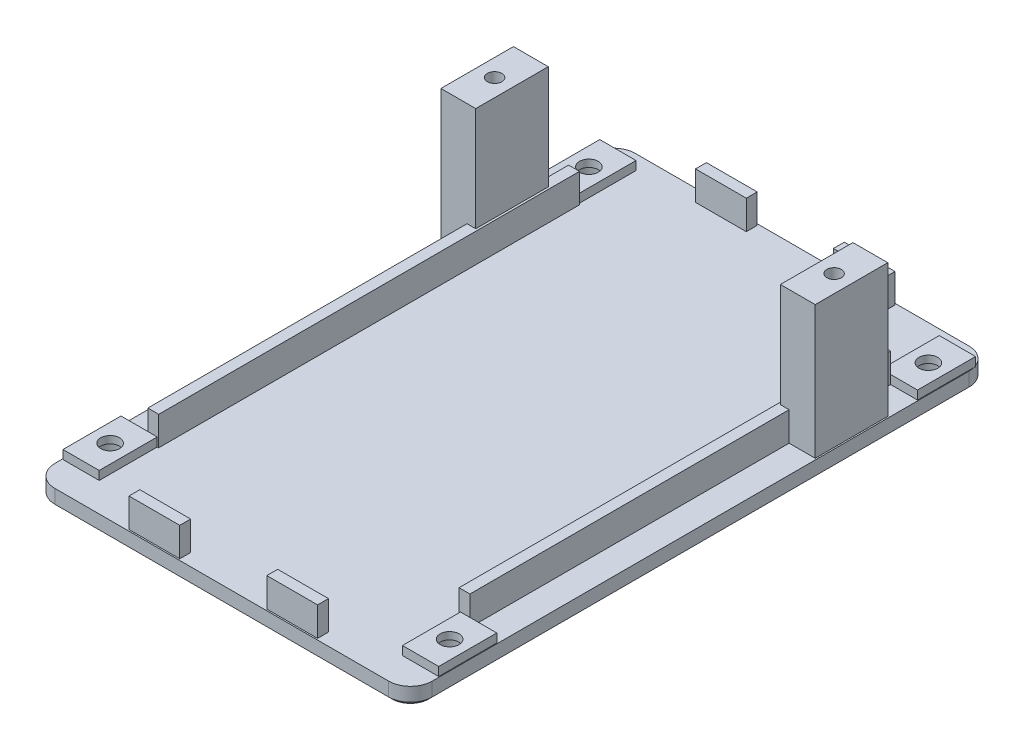
from build123d import *

# Parameters (mm, degrees)
BOSS_EXTRUDE1_DEPTH  = 2.4
CHAMFER1_SIZE        = 0.5
BOSS_EXTRUDE2_START  = -52
SKETCH2_W            = 5
SKETCH2_H            = 1.21
BOSS_EXTRUDE2_DEPTH  = 8
BOSS_EXTRUDE3_START  = 14
SKETCH3_W            = 5
SKETCH3_H            = 1.21
BOSS_EXTRUDE3_DEPTH  = 8
BOSS_EXTRUDE4_START  = -52
SKETCH4_W            = 5
SKETCH4_H            = 1.21
BOSS_EXTRUDE4_DEPTH  = 8
BOSS_EXTRUDE5_START  = 14
SKETCH5_W            = 5
SKETCH5_H            = 1.21
BOSS_EXTRUDE5_DEPTH  = 8
BOSS_EXTRUDE6_START  = -44
SKETCH6_W            = 1.5
SKETCH6_H            = 4.01
BOSS_EXTRUDE6_DEPTH  = 58
BOSS_EXTRUDE7_START  = -40
SKETCH7_W            = 4.8
SKETCH7_H            = 18.36
BOSS_EXTRUDE7_DEPTH  = 10
BOSS_EXTRUDE8_START  = 8
SKETCH8_R            = 1
BOSS_EXTRUDE8_DEPTH  = 13.75
BOSS_EXTRUDE9_START  = -53.8
SKETCH9_W            = 7
SKETCH9_H            = 4.01
BOSS_EXTRUDE9_DEPTH  = 1.5
BOSS_EXTRUDE10_START = 24.3
SKETCH10_W           = 7
SKETCH10_H           = 4.01
BOSS_EXTRUDE10_DEPTH = 1.5
BOSS_EXTRUDE11_START = -44
SKETCH11_W           = 1.5
SKETCH11_H           = 4.01
BOSS_EXTRUDE11_DEPTH = 58
BOSS_EXTRUDE12_START = -40
SKETCH12_W           = 4.8
SKETCH12_H           = 18.36
BOSS_EXTRUDE12_DEPTH = 10
BOSS_EXTRUDE13_START = 8
SKETCH13_R           = 1
BOSS_EXTRUDE13_DEPTH = 13.75
BOSS_EXTRUDE14_START = -53.8
SKETCH14_W           = 7
SKETCH14_H           = 4.01
BOSS_EXTRUDE14_DEPTH = 1.5
BOSS_EXTRUDE15_START = 24.3
SKETCH15_W           = 7
SKETCH15_H           = 4.01
BOSS_EXTRUDE15_DEPTH = 1.5
BOSS_EXTRUDE16_START = -1
SKETCH16_R           = 2.1
BOSS_EXTRUDE16_DEPTH = 3.6
BOSS_EXTRUDE17_START = 2.5
SKETCH17_R           = 1.3
BOSS_EXTRUDE17_DEPTH = 1.2
BOSS_EXTRUDE18_START = -1
SKETCH18_R           = 2.1
BOSS_EXTRUDE18_DEPTH = 3.6
BOSS_EXTRUDE19_START = 2.5
SKETCH19_R           = 1.3
BOSS_EXTRUDE19_DEPTH = 1.2
BOSS_EXTRUDE20_START = -1
SKETCH20_R           = 2.1
BOSS_EXTRUDE20_DEPTH = 3.6
BOSS_EXTRUDE21_START = 2.5
SKETCH21_R           = 1.3
BOSS_EXTRUDE21_DEPTH = 1.2
BOSS_EXTRUDE22_START = -1
SKETCH22_R           = 2.1
BOSS_EXTRUDE22_DEPTH = 3.6
BOSS_EXTRUDE23_START = 2.5
SKETCH23_R           = 1.3
BOSS_EXTRUDE23_DEPTH = 1.2
BOSS_EXTRUDE24_START = -54.1
SKETCH24_W           = 4
SKETCH24_H           = 0.9
BOSS_EXTRUDE24_DEPTH = 1


with BuildPart() as part:
    # Sketch1 → Boss-Extrude1 (new body)
    with BuildSketch(Plane(origin=(0, 0, 0), x_dir=(1, 0, 0), z_dir=(0, 1, 0))):
        with BuildLine():
            Line((-23, 54), (23, 54))
            ThreePointArc((23, 54), (25.121320344, 53.121320344), (26, 51))
            Line((26, 51), (26, -23))
            ThreePointArc((26, -23), (25.121320344, -25.121320344), (23, -26))
            Line((23, -26), (-23, -26))
            ThreePointArc((-23, -26), (-25.121320344, -25.121320344), (-26, -23))
            Line((-26, -23), (-26, 51))
            ThreePointArc((-26, 51), (-25.121320344, 53.121320344), (-23, 54))
        make_face()
    extrude(amount=BOSS_EXTRUDE1_DEPTH)

    # Chamfer1
    chamfer1_edges = [part.edges().sort_by_distance(p)[0] for p in [
        (0, 0, 26),
        (-25.121320344, 0, 25.121320344),
        (-26, 0, -14),
        (-25.121320344, 0, -53.121320344),
        (0, 0, -54),
        (25.121320344, 0, -53.121320344),
        (26, 0, -14),
        (25.121320344, 0, 25.121320344),
    ]]
    chamfer(chamfer1_edges, length=CHAMFER1_SIZE)

    # Sketch2 → Boss-Extrude2 (add)
    with BuildSketch(Plane.XY.offset(BOSS_EXTRUDE2_START)):
        with Locations((-23.4, 2.995)):
            Rectangle(SKETCH2_W, SKETCH2_H)
    extrude(amount=BOSS_EXTRUDE2_DEPTH)

    # Sketch3 → Boss-Extrude3 (add)
    with BuildSketch(Plane.XY.offset(BOSS_EXTRUDE3_START)):
        with Locations((-23.4, 2.995)):
            Rectangle(SKETCH3_W, SKETCH3_H)
    extrude(amount=BOSS_EXTRUDE3_DEPTH)

    # Sketch4 → Boss-Extrude4 (add)
    with BuildSketch(Plane.XY.offset(BOSS_EXTRUDE4_START)):
        with Locations((23.4, 2.995)):
            Rectangle(SKETCH4_W, SKETCH4_H)
    extrude(amount=BOSS_EXTRUDE4_DEPTH)

    # Sketch5 → Boss-Extrude5 (add)
    with BuildSketch(Plane.XY.offset(BOSS_EXTRUDE5_START)):
        with Locations((23.4, 2.995)):
            Rectangle(SKETCH5_W, SKETCH5_H)
    extrude(amount=BOSS_EXTRUDE5_DEPTH)

    # Sketch6 → Boss-Extrude6 (add)
    with BuildSketch(Plane.XY.offset(BOSS_EXTRUDE6_START)):
        with Locations((-21.45, 4.395)):
            Rectangle(SKETCH6_W, SKETCH6_H)
    extrude(amount=BOSS_EXTRUDE6_DEPTH)

    # Sketch7 → Boss-Extrude7 (add)
    with BuildSketch(Plane.XY.offset(BOSS_EXTRUDE7_START)):
        with Locations((-23.4, 11.57)):
            Rectangle(SKETCH7_W, SKETCH7_H)
    extrude(amount=BOSS_EXTRUDE7_DEPTH)


with BuildPart() as body_2:
    # Sketch8 → Boss-Extrude8 (new body)
    with BuildSketch(Plane(origin=(0, 0, 0), x_dir=(1, 0, 0), z_dir=(0, 1, 0)).offset(BOSS_EXTRUDE8_START)):
        with Locations(Location((-23.4, 35, 0), (0, 0, 270))):
            Circle(SKETCH8_R)
    extrude(amount=BOSS_EXTRUDE8_DEPTH)


with BuildPart() as part_1:
    add(part.part)

    # Combine1: cut body 2
    add(body_2.part, mode=Mode.SUBTRACT)

    # Sketch9 → Boss-Extrude9 (add)
    with BuildSketch(Plane.XY.offset(BOSS_EXTRUDE9_START)):
        with Locations((-9.5, 4.395)):
            Rectangle(SKETCH9_W, SKETCH9_H)
    extrude(amount=BOSS_EXTRUDE9_DEPTH)

    # Sketch10 → Boss-Extrude10 (add)
    with BuildSketch(Plane.XY.offset(BOSS_EXTRUDE10_START)):
        with Locations((-9.5, 4.395)):
            Rectangle(SKETCH10_W, SKETCH10_H)
    extrude(amount=BOSS_EXTRUDE10_DEPTH)

    # Sketch11 → Boss-Extrude11 (add)
    with BuildSketch(Plane.XY.offset(BOSS_EXTRUDE11_START)):
        with Locations((21.45, 4.395)):
            Rectangle(SKETCH11_W, SKETCH11_H)
    extrude(amount=BOSS_EXTRUDE11_DEPTH)

    # Sketch12 → Boss-Extrude12 (add)
    with BuildSketch(Plane.XY.offset(BOSS_EXTRUDE12_START)):
        with Locations((23.4, 11.57)):
            Rectangle(SKETCH12_W, SKETCH12_H)
    extrude(amount=BOSS_EXTRUDE12_DEPTH)


with BuildPart() as body_2_2:
    # Sketch13 → Boss-Extrude13 (new body)
    with BuildSketch(Plane(origin=(0, 0, 0), x_dir=(1, 0, 0), z_dir=(0, 1, 0)).offset(BOSS_EXTRUDE13_START)):
        with Locations(Location((23.4, 35, 0), (0, 0, 270))):
            Circle(SKETCH13_R)
    extrude(amount=BOSS_EXTRUDE13_DEPTH)


with BuildPart() as part_2:
    add(part_1.part)

    # Combine2: cut body 2 2
    add(body_2_2.part, mode=Mode.SUBTRACT)

    # Sketch14 → Boss-Extrude14 (add)
    with BuildSketch(Plane.XY.offset(BOSS_EXTRUDE14_START)):
        with Locations((9.5, 4.395)):
            Rectangle(SKETCH14_W, SKETCH14_H)
    extrude(amount=BOSS_EXTRUDE14_DEPTH)

    # Sketch15 → Boss-Extrude15 (add)
    with BuildSketch(Plane.XY.offset(BOSS_EXTRUDE15_START)):
        with Locations((9.5, 4.395)):
            Rectangle(SKETCH15_W, SKETCH15_H)
    extrude(amount=BOSS_EXTRUDE15_DEPTH)


with BuildPart() as body_2_3:
    # Sketch16 → Boss-Extrude16 (new body)
    with BuildSketch(Plane(origin=(0, 0, 0), x_dir=(1, 0, 0), z_dir=(0, 1, 0)).offset(BOSS_EXTRUDE16_START)):
        with Locations(Location((-23.4, 48, 0), (0, 0, 270))):
            Circle(SKETCH16_R)
    extrude(amount=BOSS_EXTRUDE16_DEPTH)


with BuildPart() as part_3:
    add(part_2.part)

    # Combine3: cut body 2 3
    add(body_2_3.part, mode=Mode.SUBTRACT)


with BuildPart() as body_2_4:
    # Sketch17 → Boss-Extrude17 (new body)
    with BuildSketch(Plane(origin=(0, 0, 0), x_dir=(1, 0, 0), z_dir=(0, 1, 0)).offset(BOSS_EXTRUDE17_START)):
        with Locations(Location((-23.4, 48, 0), (0, 0, 270))):
            Circle(SKETCH17_R)
    extrude(amount=BOSS_EXTRUDE17_DEPTH)


with BuildPart() as part_4:
    add(part_3.part)

    # Combine4: cut body 2 4
    add(body_2_4.part, mode=Mode.SUBTRACT)


with BuildPart() as body_2_5:
    # Sketch18 → Boss-Extrude18 (new body)
    with BuildSketch(Plane(origin=(0, 0, 0), x_dir=(1, 0, 0), z_dir=(0, 1, 0)).offset(BOSS_EXTRUDE18_START)):
        with Locations(Location((-23.4, -18, 0), (0, 0, 270))):
            Circle(SKETCH18_R)
    extrude(amount=BOSS_EXTRUDE18_DEPTH)


with BuildPart() as part_5:
    add(part_4.part)

    # Combine5: cut body 2 5
    add(body_2_5.part, mode=Mode.SUBTRACT)


with BuildPart() as body_2_6:
    # Sketch19 → Boss-Extrude19 (new body)
    with BuildSketch(Plane(origin=(0, 0, 0), x_dir=(1, 0, 0), z_dir=(0, 1, 0)).offset(BOSS_EXTRUDE19_START)):
        with Locations(Location((-23.4, -18, 0), (0, 0, 270))):
            Circle(SKETCH19_R)
    extrude(amount=BOSS_EXTRUDE19_DEPTH)


with BuildPart() as part_6:
    add(part_5.part)

    # Combine6: cut body 2 6
    add(body_2_6.part, mode=Mode.SUBTRACT)


with BuildPart() as body_2_7:
    # Sketch20 → Boss-Extrude20 (new body)
    with BuildSketch(Plane(origin=(0, 0, 0), x_dir=(1, 0, 0), z_dir=(0, 1, 0)).offset(BOSS_EXTRUDE20_START)):
        with Locations(Location((23.4, 48, 0), (0, 0, 270))):
            Circle(SKETCH20_R)
    extrude(amount=BOSS_EXTRUDE20_DEPTH)


with BuildPart() as part_7:
    add(part_6.part)

    # Combine7: cut body 2 7
    add(body_2_7.part, mode=Mode.SUBTRACT)


with BuildPart() as body_2_8:
    # Sketch21 → Boss-Extrude21 (new body)
    with BuildSketch(Plane(origin=(0, 0, 0), x_dir=(1, 0, 0), z_dir=(0, 1, 0)).offset(BOSS_EXTRUDE21_START)):
        with Locations(Location((23.4, 48, 0), (0, 0, 270))):
            Circle(SKETCH21_R)
    extrude(amount=BOSS_EXTRUDE21_DEPTH)


with BuildPart() as part_8:
    add(part_7.part)

    # Combine8: cut body 2 8
    add(body_2_8.part, mode=Mode.SUBTRACT)


with BuildPart() as body_2_9:
    # Sketch22 → Boss-Extrude22 (new body)
    with BuildSketch(Plane(origin=(0, 0, 0), x_dir=(1, 0, 0), z_dir=(0, 1, 0)).offset(BOSS_EXTRUDE22_START)):
        with Locations(Location((23.4, -18, 0), (0, 0, 270))):
            Circle(SKETCH22_R)
    extrude(amount=BOSS_EXTRUDE22_DEPTH)


with BuildPart() as part_9:
    add(part_8.part)

    # Combine9: cut body 2 9
    add(body_2_9.part, mode=Mode.SUBTRACT)


with BuildPart() as body_2_10:
    # Sketch23 → Boss-Extrude23 (new body)
    with BuildSketch(Plane(origin=(0, 0, 0), x_dir=(1, 0, 0), z_dir=(0, 1, 0)).offset(BOSS_EXTRUDE23_START)):
        with Locations(Location((23.4, -18, 0), (0, 0, 270))):
            Circle(SKETCH23_R)
    extrude(amount=BOSS_EXTRUDE23_DEPTH)


with BuildPart() as part_10:
    add(part_9.part)

    # Combine10: cut body 2 10
    add(body_2_10.part, mode=Mode.SUBTRACT)


with BuildPart() as body_2_11:
    # Sketch24 → Boss-Extrude24 (new body)
    with BuildSketch(Plane.XY.offset(BOSS_EXTRUDE24_START)):
        with Locations((0, 0.35)):
            Rectangle(SKETCH24_W, SKETCH24_H)
    extrude(amount=BOSS_EXTRUDE24_DEPTH)


with BuildPart() as part_11:
    add(part_10.part)

    # Combine11: cut body 2 11
    add(body_2_11.part, mode=Mode.SUBTRACT)


solid = part_11.part
